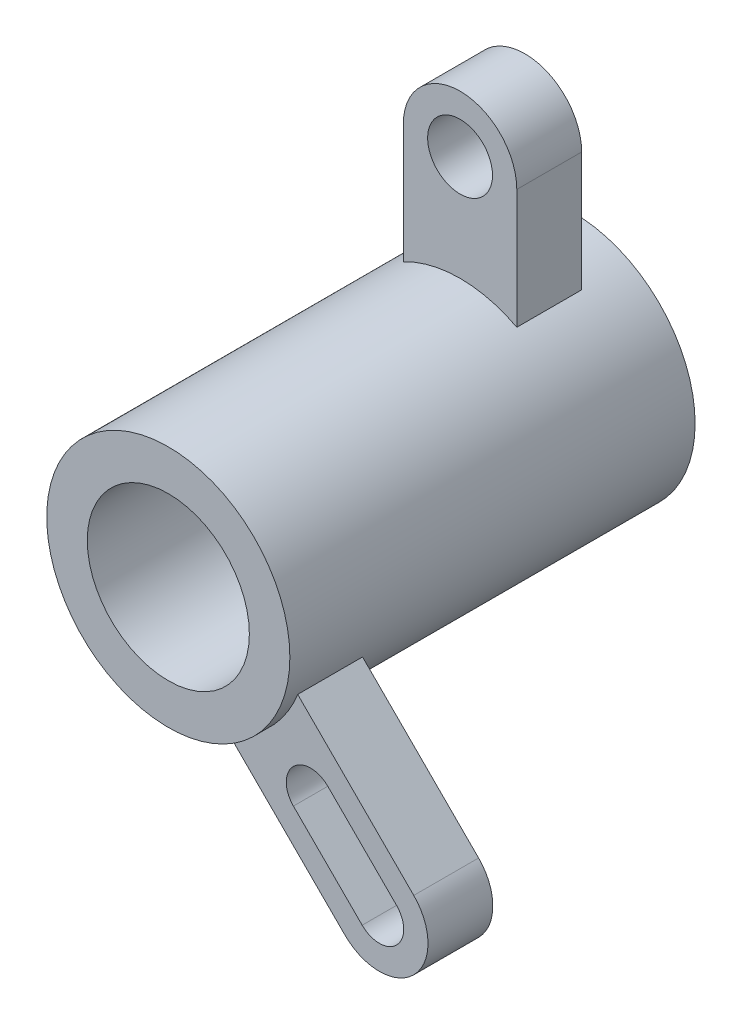
from build123d import *

# Parameters (mm, degrees)
SKETCH_1_R      = 7.5
SKETCH_1_R_2    = 5
EXTRUDE_1_DEPTH = 25
EXTRUDE_START   = 3
SKETCH_1_3_R    = 2
EXTRUDE_2_DEPTH = 4
EXTRUDE_START_2 = 20
EXTRUDE_3_DEPTH = 4


with BuildPart() as part:
    # Эскиз1 → Бобышка-Вытянуть1 (new body)
    with BuildSketch(Plane.XY):
        Circle(SKETCH_1_R)
        Circle(SKETCH_1_R_2, mode=Mode.SUBTRACT)
    extrude(amount=EXTRUDE_1_DEPTH)

    # Эскиз1<3> → Бобышка-Вытянуть2 (add)
    with BuildSketch(Plane.XY.offset(EXTRUDE_START)):
        with BuildLine():
            Line((-3.5, 14), (-3.5, 6.633249581))
            ThreePointArc((-3.5, 6.633249581), (0, 7.5), (3.5, 6.633249581))
            Line((3.5, 6.633249581), (3.5, 14))
            ThreePointArc((3.5, 14), (0, 17.5), (-3.5, 14))
        make_face()
        with Locations((0, 14)):
            Circle(SKETCH_1_3_R, mode=Mode.SUBTRACT)
    extrude(amount=EXTRUDE_2_DEPTH)

    # Эскиз1<4> → Бобышка-Вытянуть3 (add)
    with BuildSketch(Plane.XY.offset(EXTRUDE_START_2)):
        with BuildLine():
            ThreePointArc((6.981875867, -2.73923518), (5.303300859, -5.303300859), (2.73923518, -6.981875867))
            Line((2.73923518, -6.981875867), (9.899494937, -14.142135624))
            ThreePointArc((9.899494937, -14.142135624), (14.142135624, -14.142135624), (14.142135624, -9.899494937))
            Line((14.142135624, -9.899494937), (6.981875867, -2.73923518))
        make_face()
        with BuildLine():
            ThreePointArc((13.081475452, -10.960155108), (13.081475452, -13.081475452), (10.960155108, -13.081475452))
            Line((10.960155108, -13.081475452), (6.717514421, -8.838834765))
            ThreePointArc((6.717514421, -8.838834765), (6.717514421, -6.717514421), (8.838834765, -6.717514421))
            Line((8.838834765, -6.717514421), (13.081475452, -10.960155108))
        make_face(mode=Mode.SUBTRACT)
    extrude(amount=EXTRUDE_3_DEPTH)


solid = part.part
